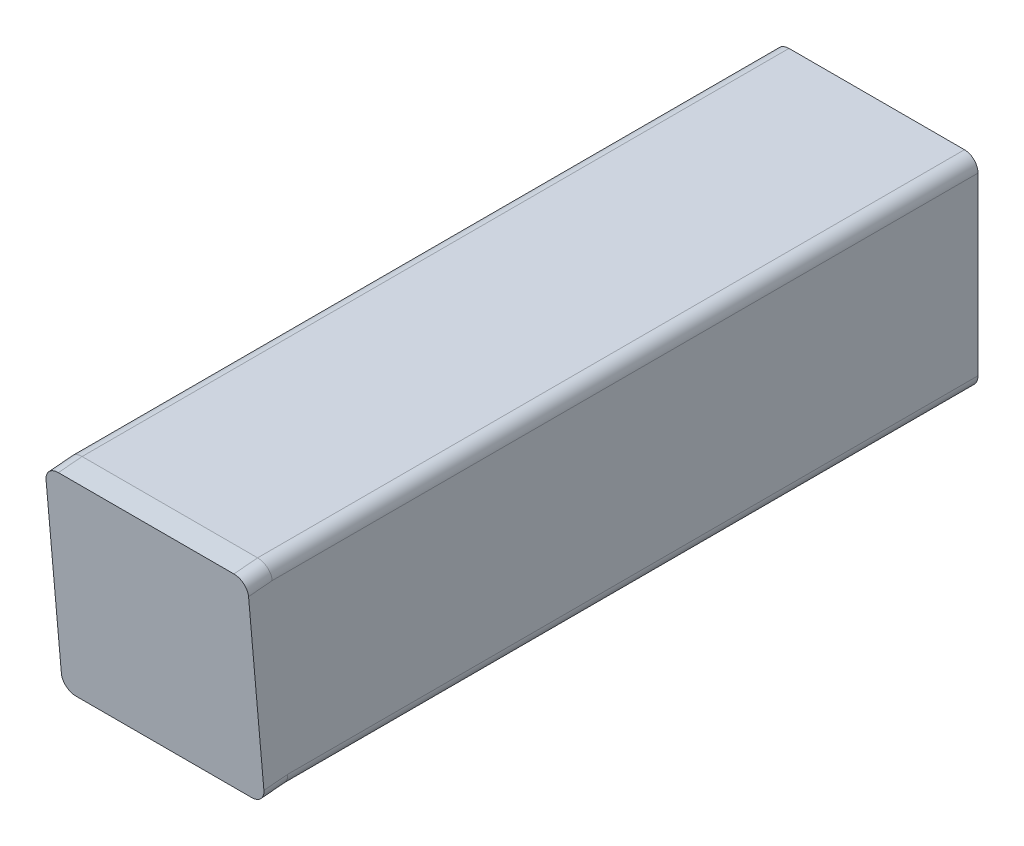
from build123d import *

# Parameters (mm, degrees)
BOSS_EXTRUDE1_DEPTH = 133
CUT_EXTRUDE1_DEPTH  = 144.49989547
BOSS_EXTRUDE2_DEPTH = 4.480838922


with BuildPart() as part:
    # Sketch1 → Boss-Extrude1 (new body)
    with BuildSketch(Plane.XY):
        with BuildLine():
            Line((2.54, 0), (35.56, 0))
            ThreePointArc((35.56, 0), (37.356051224, -0.743948776), (38.1, -2.54))
            Line((38.1, -2.54), (38.1, -35.56))
            ThreePointArc((38.1, -35.56), (37.356051224, -37.356051224), (35.56, -38.1))
            Line((35.56, -38.1), (2.54, -38.1))
            ThreePointArc((2.54, -38.1), (0.743948776, -37.356051224), (0, -35.56))
            Line((0, -35.56), (0, -2.54))
            ThreePointArc((0, -2.54), (0.743948776, -0.743948776), (2.54, 0))
        make_face()
        with BuildLine():
            Line((5.3086, -2.7686), (32.7914, -2.7686))
            ThreePointArc((32.7914, -2.7686), (34.587451224, -3.512548776), (35.3314, -5.3086))
            Line((35.3314, -5.3086), (35.3314, -32.7914))
            ThreePointArc((35.3314, -32.7914), (34.587451224, -34.587451224), (32.7914, -35.3314))
            Line((32.7914, -35.3314), (5.3086, -35.3314))
            ThreePointArc((5.3086, -35.3314), (3.512548776, -34.587451224), (2.7686, -32.7914))
            Line((2.7686, -32.7914), (2.7686, -5.3086))
            ThreePointArc((2.7686, -5.3086), (3.512548776, -3.512548776), (5.3086, -2.7686))
        make_face(mode=Mode.SUBTRACT)
    extrude(amount=BOSS_EXTRUDE1_DEPTH)

    # Sketch2 → Cut-Extrude1 (cut, through all)
    with BuildSketch(Plane(origin=(38.1, 0, 0), x_dir=(0, 0, -1), z_dir=(1, 0, 0))):
        Polygon((-133, 0), (-129.66668192, -38.1), (-133, -38.1), align=None)
    extrude(amount=-CUT_EXTRUDE1_DEPTH, mode=Mode.SUBTRACT)

    # Sketch3 → Boss-Extrude2 (add)
    with BuildSketch(Plane(origin=(0, -11.547603815, 131.989715575), x_dir=(1, 0, 0), z_dir=(0, -0.08715574274765185, 0.9961946980917462))):
        with BuildLine():
            Line((2.54, -26.653822025), (35.56, -26.653822025))
            add(Edge.make_bspline(
                [(35.56, -26.653822025), (38.1, -26.653822025), (38.1, -24.104119638)],
                knots=[0, 0, 0, 1.570796327, 1.570796327, 1.570796327], degree=2, weights=[1, 0.707106781, 1]))
            Line((38.1, -24.104119638), (38.1, 9.042011398))
            add(Edge.make_bspline(
                [(38.1, 9.042011398), (38.1, 11.591713785), (35.56, 11.591713785)],
                knots=[1.570796327, 1.570796327, 1.570796327, 3.141592654, 3.141592654, 3.141592654], degree=2, weights=[1, 0.707106781, 1]))
            Line((35.56, 11.591713785), (2.54, 11.591713785))
            add(Edge.make_bspline(
                [(2.54, 11.591713785), (0, 11.591713785), (0, 9.042011398)],
                knots=[0, 0, 0, 1.570796327, 1.570796327, 1.570796327], degree=2, weights=[1, 0.707106781, 1]))
            Line((0, 9.042011398), (0, -24.104119638))
            add(Edge.make_bspline(
                [(0, -24.104119638), (0, -26.653822025), (2.54, -26.653822025)],
                knots=[4.71238898, 4.71238898, 4.71238898, 6.283185307, 6.283185307, 6.283185307], degree=2, weights=[1, 0.707106781, 1]))
        make_face()
    extrude(amount=BOSS_EXTRUDE2_DEPTH)


solid = part.part
